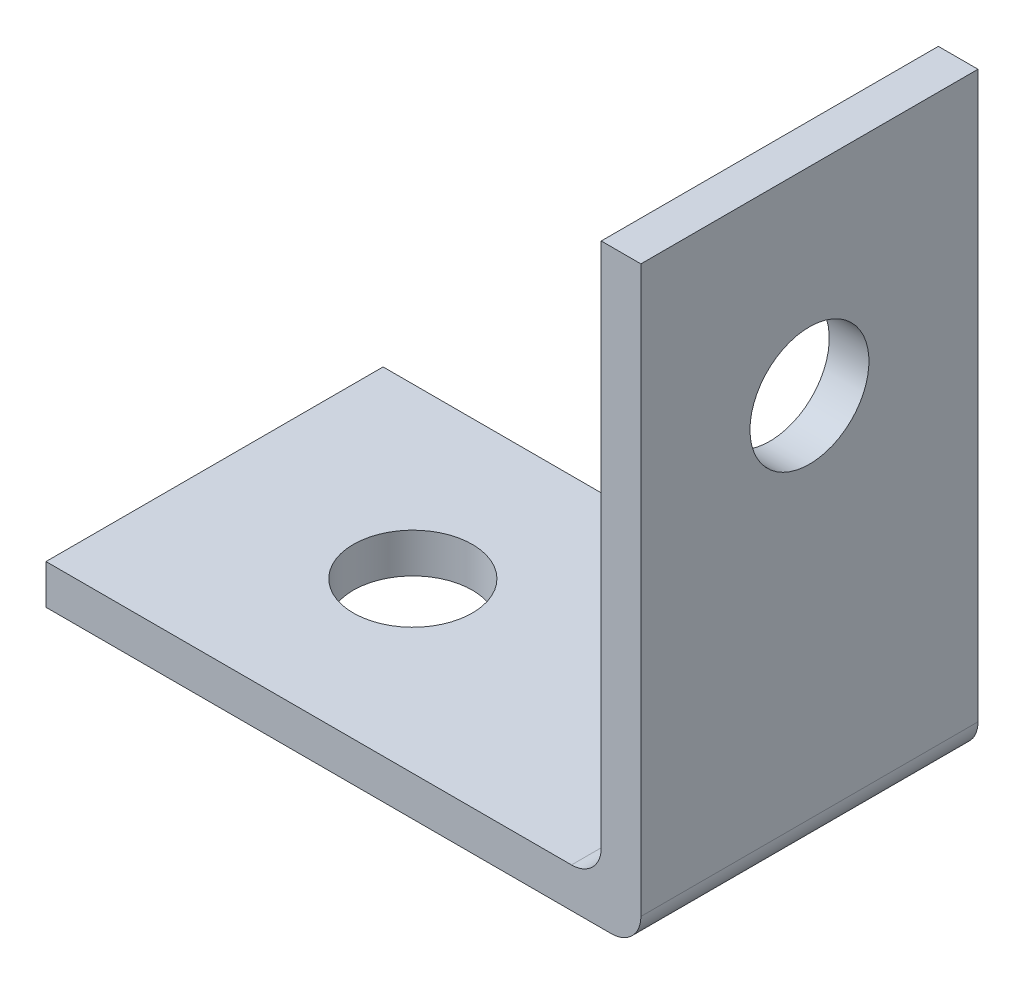
from build123d import *

# Parameters (mm, degrees)
BOSS_EXTRUDE1_DEPTH = 17
SKETCH3_R           = 3
CUT_EXTRUDE1_DEPTH  = 45.418464629
SKETCH4_R           = 3
CUT_EXTRUDE2_DEPTH  = 45.418464629


with BuildPart() as part:
    # Sketch2 → Boss-Extrude1 (new body)
    with BuildSketch(Plane.XY):
        with BuildLine():
            Line((0, 0), (28.5, 0))
            ThreePointArc((28.5, 0), (29.560660172, 0.439339828), (30, 1.5))
            Line((30, 1.5), (30, 30))
            Line((30, 30), (28, 30))
            Line((28, 30), (28, 3.5))
            ThreePointArc((28, 3.5), (27.560660172, 2.439339828), (26.5, 2))
            Line((26.5, 2), (0, 2))
            Line((0, 2), (0, 0))
        make_face()
    extrude(amount=BOSS_EXTRUDE1_DEPTH)

    # Sketch3 → Cut-Extrude1 (cut, through all)
    with BuildSketch(Plane.ZY.offset(-28)):
        with Locations((8.5, 20)):
            Circle(SKETCH3_R)
    extrude(amount=-CUT_EXTRUDE1_DEPTH, mode=Mode.SUBTRACT)

    # Sketch4 → Cut-Extrude2 (cut, through all)
    with BuildSketch(Plane(origin=(0, 2, 0), x_dir=(1, 0, 0), z_dir=(0, 1, 0))):
        with Locations(Location((10, -8.5, 0), (0, 0, 180))):
            Circle(SKETCH4_R)
    extrude(amount=-CUT_EXTRUDE2_DEPTH, mode=Mode.SUBTRACT)


solid = part.part
